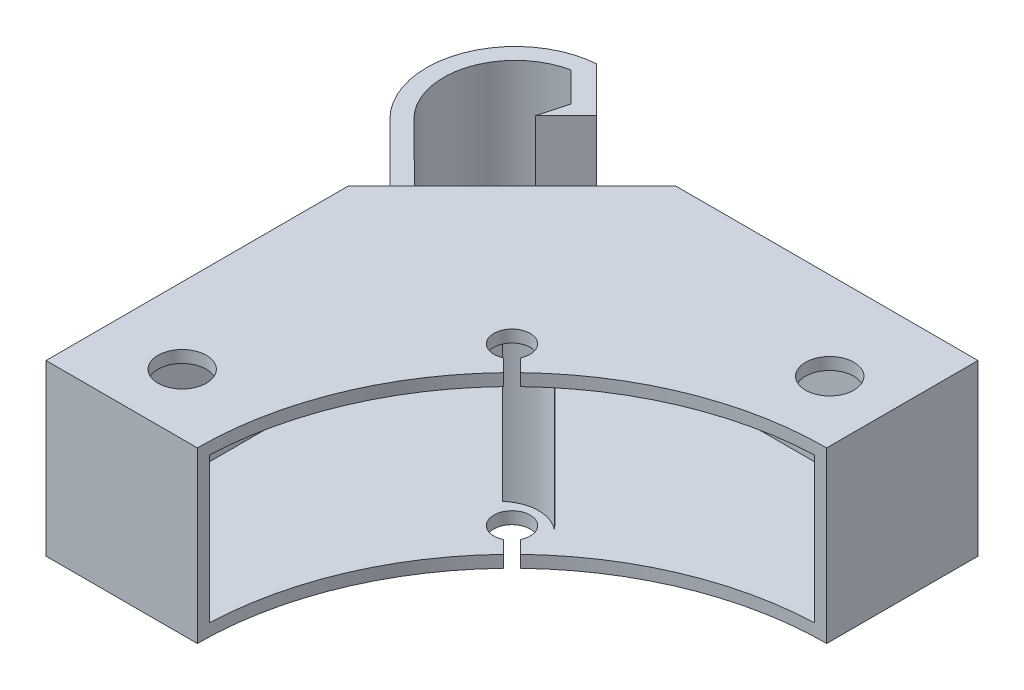
from build123d import *

# Parameters (mm, degrees)
BOSS_EXTRUDE1_DEPTH     = 28
SHELL1_T                = -2
CUT_EXTRUDE1_DEPTH      = 12
CUT_EXTRUDE1_DEPTH_BACK = 12
SKETCH9_R               = 6.4
SKETCH12_R              = 4
CUT_EXTRUDE3_DEPTH      = 2
SKETCH17_W              = 36.183766184
SKETCH17_H              = 26
BOSS_EXTRUDE2_DEPTH     = 30
CUT_EXTRUDE14_DEPTH     = 30


with BuildPart() as part:
    # Sketch1 → Boss-Extrude1 (new body)
    with BuildSketch(Plane(origin=(0, 0, 0), x_dir=(1, 0, 0), z_dir=(0, 1, 0))):
        with BuildLine():
            Line((0, 0), (0, 50))
            Line((0, 50), (27, 77))
            Line((27, 77), (77, 77))
            Line((77, 77), (77, 52))
            ThreePointArc((77, 52), (57.56334266, 48.230865133), (40.944353892, 37.46985967))
            Line((40.944353892, 37.46985967), (38.823033548, 39.591180014))
            ThreePointArc((38.823033548, 39.591180014), (33.994606424, 43.005393576), (37.408819986, 38.176966452))
            Line((37.408819986, 38.176966452), (39.53014033, 36.055646108))
            ThreePointArc((39.53014033, 36.055646108), (28.769134867, 19.43665734), (25, 0))
            Line((25, 0), (0, 0))
        make_face()
    extrude(amount=BOSS_EXTRUDE1_DEPTH)

    # Shell1
    shell1_openings = [part.faces().sort_by_distance(p)[0] for p in [
        (57.56334266, 14, -48.230865133),
        (28.769134867, 14, -19.43665734),
    ]]
    offset(amount=SHELL1_T, openings=shell1_openings, kind=Kind.INTERSECTION)

    # Sketch9 → Cut-Extrude1 (cut, two sides: drawn at the far end of the back side and taken through both)
    with BuildSketch(Plane(origin=(0, 14, 0), x_dir=(1, 0, 0), z_dir=(0, 1, 0)).offset(-CUT_EXTRUDE1_DEPTH_BACK)):
        with Locations((36.184678266, 38.815321734)):
            Circle(SKETCH9_R)
    extrude(amount=CUT_EXTRUDE1_DEPTH + CUT_EXTRUDE1_DEPTH_BACK, mode=Mode.SUBTRACT)

    # Sketch12 → Cut-Extrude3 (cut)
    with BuildSketch(Plane(origin=(0, 28, 0), x_dir=(1, 0, 0), z_dir=(0, 1, 0))):
        with Locations((67, 62.5)):
            Circle(SKETCH12_R)
        with Locations((12.5, 10)):
            Circle(SKETCH12_R)
    extrude(amount=-CUT_EXTRUDE3_DEPTH, mode=Mode.SUBTRACT)

    # Sketch17 → Boss-Extrude2 (add)
    with BuildSketch(Plane(origin=(-25, 0, -25), x_dir=(-0.7071067811865435, 0, 0.7071067811865516), z_dir=(-0.7071067811865516, 0, -0.7071067811865435))):
        with Locations((-54.447222151, 14)):
            Rectangle(SKETCH17_W, SKETCH17_H)
    extrude(amount=BOSS_EXTRUDE2_DEPTH)

    # Sketch19<7> → Cut-Extrude14 (cut)
    with BuildSketch(Plane(origin=(0, 27, 0), x_dir=(1, 0, 0), z_dir=(0, 1, 0))):
        with BuildLine():
            Line((-7.176599947, 64.001557861), (3.412478957, 53.412478957))
            Line((3.412478957, 53.412478957), (0.707106781, 50.707106781))
            Line((0.707106781, 50.707106781), (-20.506096654, 71.920310217))
            Line((-20.506096654, 71.920310217), (5.079689783, 97.506096654))
            Line((5.079689783, 97.506096654), (26.292893219, 76.292893219))
            Line((26.292893219, 76.292893219), (5.445665953, 55.445665953))
            Line((5.445665953, 55.445665953), (-5.153515959, 65.947132971))
            ThreePointArc((-5.153515959, 65.947132971), (-8.165921561, 77.734505129), (0.807292373, 85.950231609))
            Line((0.807292373, 85.950231609), (5.671042553, 81.08648143))
            Line((5.671042553, 81.08648143), (4.410448732, 76.512705214))
            Line((4.410448732, 76.512705214), (9.448954094, 81.551210575))
            Line((9.448954094, 81.551210575), (2.047814256, 88.952350413))
            ThreePointArc((2.047814256, 88.952350413), (-10.556487738, 79.431665635), (-7.176599947, 64.001557861))
        make_face()
    extrude(amount=-CUT_EXTRUDE14_DEPTH, mode=Mode.SUBTRACT)


solid = part.part
